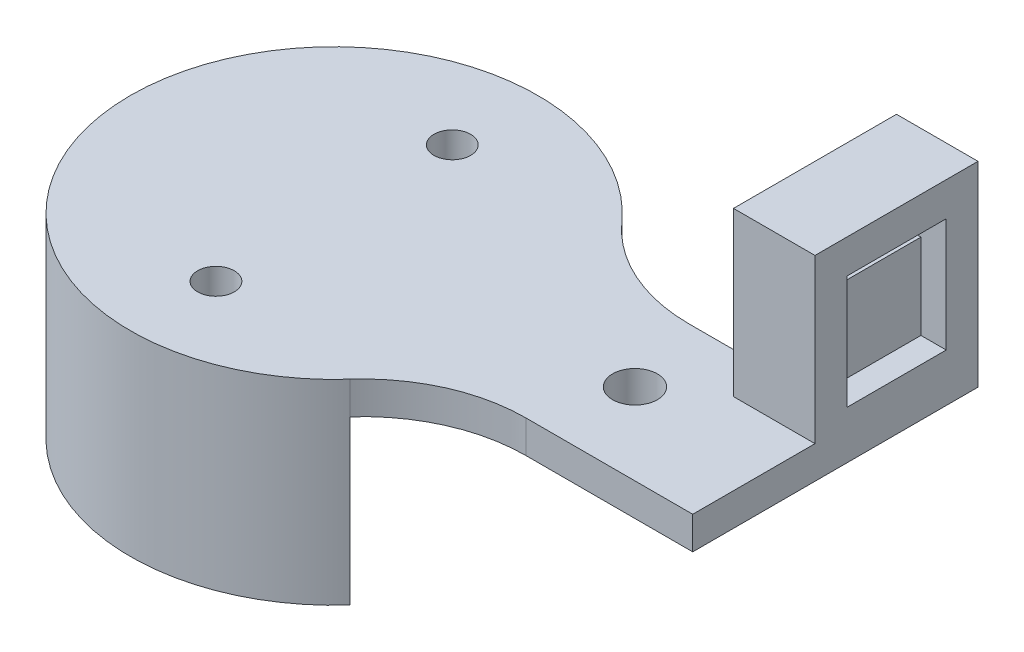
from build123d import *

# Parameters (mm, degrees)
BOSS_EXTRUDE1_DEPTH = 4
FILLET1_R           = 20
SKETCH1_R           = 2.25
SKETCH1_R_2         = 2.75
CUT_EXTRUDE3_DEPTH  = 131.855321132
BOSS_EXTRUDE2_START = 20
BOSS_EXTRUDE2_DEPTH = 20
SKETCH7_W           = 10
SKETCH7_H           = 20
BOSS_EXTRUDE3_DEPTH = 20
SKETCH8_W           = 12.2
SKETCH8_H           = 12.2
CUT_EXTRUDE4_DEPTH  = 3.1
CUT_EXTRUDE5_REACH  = 88.267
SKETCH8_3_W         = 12.2
SKETCH8_3_H         = 3.5


with BuildPart() as part:
    # Sketch3 → Boss-Extrude1 (new body)
    with BuildSketch(Plane(origin=(0, 0, 0), x_dir=(1, 0, 0), z_dir=(0, 1, 0))):
        with BuildLine():
            Line((22.912878475, 10), (44, 10))
            Line((44, 10), (44, 25))
            Line((44, 25), (54, 25))
            Line((54, 25), (54, -10))
            Line((54, -10), (22.912878475, -10))
            ThreePointArc((22.912878475, -10), (-25, 0), (22.912878475, 10))
        make_face()
    extrude(amount=BOSS_EXTRUDE1_DEPTH)

    # Fillet1
    fillet1_edges = [part.edges().sort_by_distance(p)[0] for p in [
        (22.912878475, 2, 10),
        (22.912878475, 2, -10),
    ]]
    fillet(fillet1_edges, radius=FILLET1_R)

    # Sketch1 → Cut-Extrude3 (cut, through all)
    with BuildSketch(Plane(origin=(103.38268991, 0, 0), x_dir=(1, 0, 0), z_dir=(0, 1, 0))):
        with Locations((-103.38268991, 14.5)):
            Circle(SKETCH1_R)
        with Locations((-103.38268991, -14.5)):
            Circle(SKETCH1_R)
        with Locations((-66.469811435, 0)):
            Circle(SKETCH1_R_2)
    extrude(amount=CUT_EXTRUDE3_DEPTH, mode=Mode.SUBTRACT)

    # Sketch4 → Boss-Extrude2 (add)
    with BuildSketch(Plane.XZ.offset(BOSS_EXTRUDE2_START)):
        with BuildLine():
            Line((18.633899812, 16.666666667), (17.452315988, 15.609825965))
            ThreePointArc((17.452315988, 15.609825965), (16.092851842, 15.100708662), (14.747154343, 15.645173018))
            ThreePointArc((14.747154343, 15.645173018), (-21.5, 0), (14.747154343, -15.645173018))
            ThreePointArc((14.747154343, -15.645173018), (16.092851842, -15.100708662), (17.452315988, -15.609825965))
            Line((17.452315988, -15.609825965), (18.633899812, -16.666666667))
            ThreePointArc((18.633899812, -16.666666667), (-25, 0), (18.633899812, 16.666666667))
        make_face()
    extrude(amount=-BOSS_EXTRUDE2_DEPTH)

    # Sketch7 → Boss-Extrude3 (add)
    with BuildSketch(Plane(origin=(0, 4, 0), x_dir=(1, 0, 0), z_dir=(0, 1, 0))):
        with Locations((49, 15)):
            Rectangle(SKETCH7_W, SKETCH7_H)
    extrude(amount=BOSS_EXTRUDE3_DEPTH)

    # Sketch8 → Cut-Extrude4 (cut)
    with BuildSketch(Plane(origin=(54, 0, 0), x_dir=(0, 0, -1), z_dir=(1, 0, 0))):
        with Locations((15, 12)):
            Rectangle(SKETCH8_W, SKETCH8_H)
    extrude(amount=-CUT_EXTRUDE4_DEPTH, mode=Mode.SUBTRACT)

    # Sketch8<3> → Cut-Extrude5 (cut, up to next)
    with BuildSketch(Plane(origin=(54, 0, 0), x_dir=(0, 0, -1), z_dir=(1, 0, 0)), mode=Mode.PRIVATE) as cut_extrude5_sk1:
        with Locations((15, 18.1)):
            Rectangle(SKETCH8_3_W, SKETCH8_3_H)
    cut_extrude5_tool1 = extrude(cut_extrude5_sk1.sketch, amount=-CUT_EXTRUDE5_REACH, mode=Mode.PRIVATE) & part.part
    add(cut_extrude5_tool1.solids().sort_by_distance((54, 18.1, -15))[0], mode=Mode.SUBTRACT)


solid = part.part
